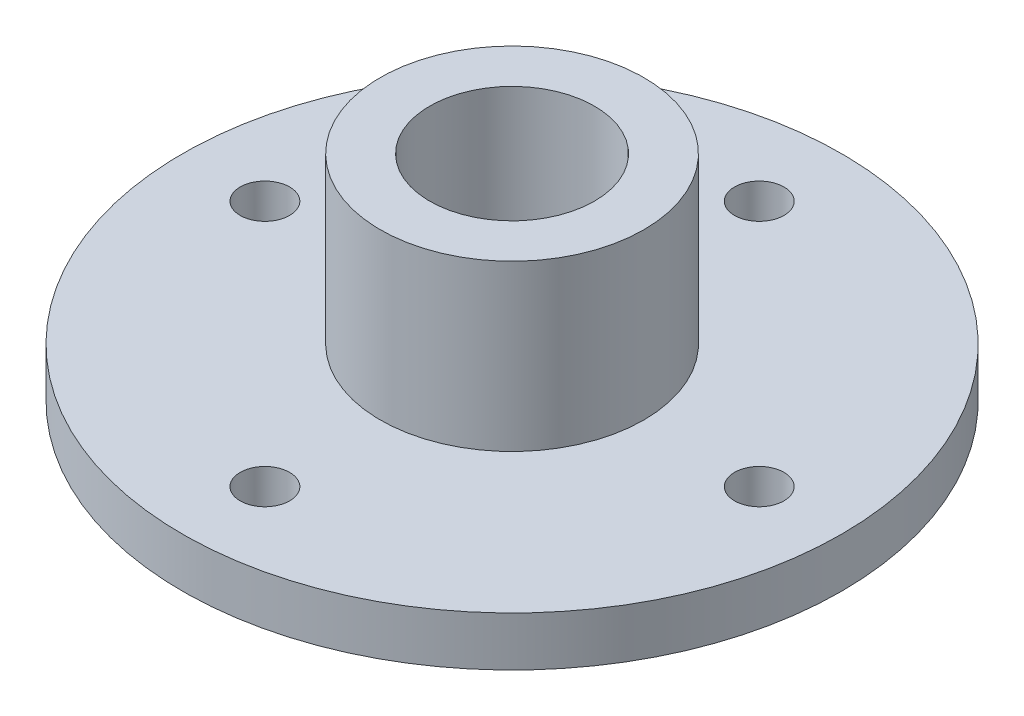
from build123d import *

# Parameters (mm, degrees)
CUT_EXTRUDE_1_DEPTH      = 31
CUT_EXTRUDE_1_DEPTH_BACK = 31
SKETCH_2_R               = 1.5


with BuildPart() as part:
    # 草图1 → 旋转1 (revolve)
    with BuildSketch(Plane.XY, mode=Mode.PRIVATE) as revolve_1_sk:
        Polygon((-5, 0), (-20, 0), (-20, 3), (-8, 3), (-8, 13), (-5, 13), align=None)
    revolve(revolve_1_sk.sketch.rotate(Axis((0, -573.614855465, 0), (0, 1, 0)), 180), axis=Axis((0, -573.614855465, 0), (0, 1, 0)))

    # 草图2 → 切除-拉伸1 (cut, two sides: drawn at the far end of the back side and taken through both)
    with BuildSketch(Plane(origin=(0, 3, 0), x_dir=(1, 0, 0), z_dir=(0, 1, 0)).offset(-CUT_EXTRUDE_1_DEPTH_BACK)):
        with Locations(Location((0, 15, 0), (0, 0, 180))):
            Circle(SKETCH_2_R)
        with Locations(Location((15, 0, 0), (0, 0, 180))):
            Circle(SKETCH_2_R)
        with Locations(Location((0, -15, 0), (0, 0, 180))):
            Circle(SKETCH_2_R)
        with Locations(Location((-15, 0, 0), (0, 0, 180))):
            Circle(SKETCH_2_R)
    extrude(amount=CUT_EXTRUDE_1_DEPTH + CUT_EXTRUDE_1_DEPTH_BACK, mode=Mode.SUBTRACT)


solid = part.part
